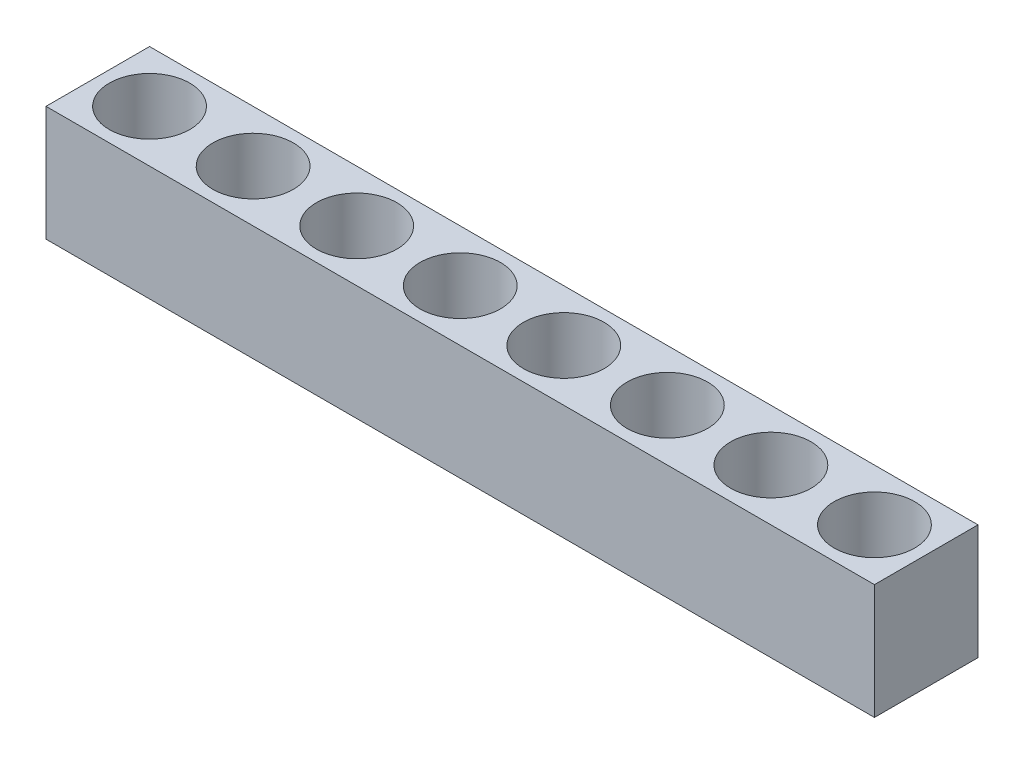
from build123d import *

# Parameters (mm, degrees)
SKETCH1_W           = 72
SKETCH1_H           = 9
SKETCH1_R           = 3.5
BOSS_EXTRUDE1_DEPTH = 10


with BuildPart() as part:
    # Sketch1 → Boss-Extrude1 (new body)
    with BuildSketch(Plane(origin=(0, 0, 0), x_dir=(1, 0, 0), z_dir=(0, 1, 0))):
        Rectangle(SKETCH1_W, SKETCH1_H)
        with Locations(Location((-4.5, 0, 0), (0, 0, 270))):
            Circle(SKETCH1_R, mode=Mode.SUBTRACT)
        with Locations(Location((4.5, 0, 0), (0, 0, 270))):
            Circle(SKETCH1_R, mode=Mode.SUBTRACT)
        with Locations(Location((13.5, 0, 0), (0, 0, 270))):
            Circle(SKETCH1_R, mode=Mode.SUBTRACT)
        with Locations(Location((22.5, 0, 0), (0, 0, 270))):
            Circle(SKETCH1_R, mode=Mode.SUBTRACT)
        with Locations(Location((31.5, 0, 0), (0, 0, 270))):
            Circle(SKETCH1_R, mode=Mode.SUBTRACT)
        with Locations(Location((-13.5, 0, 0), (0, 0, 270))):
            Circle(SKETCH1_R, mode=Mode.SUBTRACT)
        with Locations(Location((-22.5, 0, 0), (0, 0, 270))):
            Circle(SKETCH1_R, mode=Mode.SUBTRACT)
        with Locations(Location((-31.5, 0, 0), (0, 0, 270))):
            Circle(SKETCH1_R, mode=Mode.SUBTRACT)
    extrude(amount=-BOSS_EXTRUDE1_DEPTH)


solid = part.part
